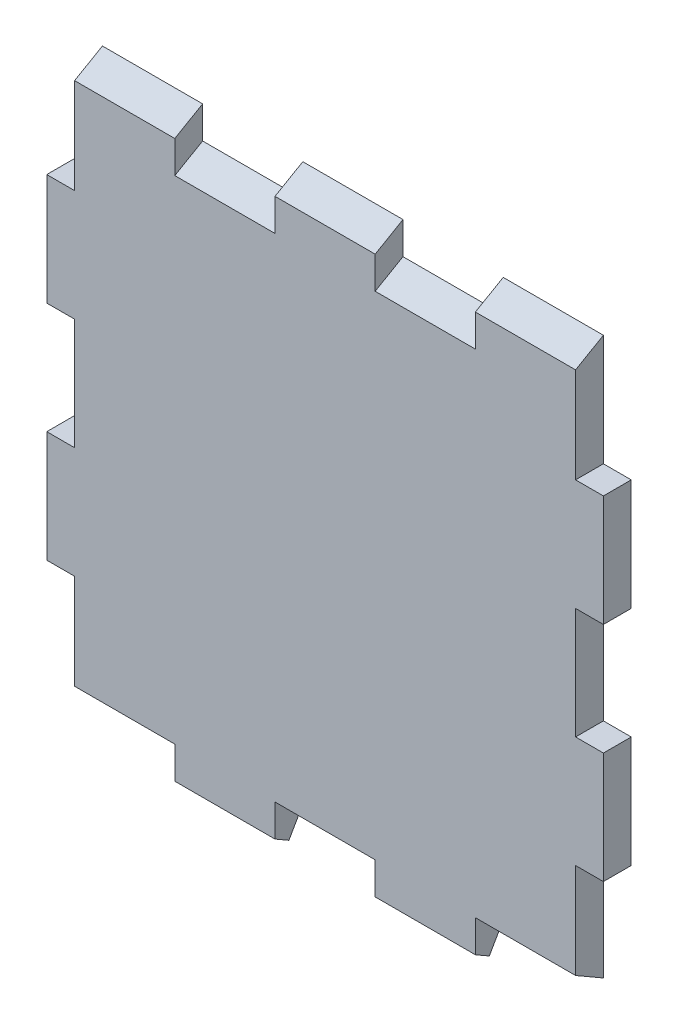
from build123d import *

# Parameters (mm, degrees)
ESQUISSE1_W                    = 90
ESQUISSE1_H                    = 100
BOSS_EXTRU_3_DEPTH             = 5
ENL_V_MAT_EXTRU_3_DEPTH        = 135.629120178
BOSS_EXTRU_4_DEPTH             = 90
ESQUISSE7_W                    = 18
ESQUISSE7_H                    = 5.773502692
ENL_V_MAT_EXTRU_4_DEPTH        = 137.787000854
ESQUISSE8_W                    = 18
ESQUISSE8_H                    = 5
ENL_V_MAT_EXTRU_5_DEPTH        = 133.498992691
ESQUISSE9_W                    = 18
ESQUISSE9_H                    = 5
ENL_V_MAT_EXTRU_6_DEPTH        = 133.498992691
BOSS_EXTRU_5_REACH             = 118.304
BOSS_EXTRU_5_DIRECTION_2_REACH = 118.304
ESQUISSE11_W                   = 18
ESQUISSE11_H                   = 13
BOSS_EXTRU_6_DEPTH             = 5
ENL_V_MAT_EXTRU_7_DEPTH        = 135.082064423
ESQUISSE13_W                   = 5
ESQUISSE13_H                   = 20
BOSS_EXTRU_7_DEPTH             = 5


with BuildPart() as part:
    # Esquisse1 → Boss.-Extru.3 (new body)
    with BuildSketch(Plane.XY):
        with Locations((-45, -50)):
            Rectangle(ESQUISSE1_W, ESQUISSE1_H)
    extrude(amount=BOSS_EXTRU_3_DEPTH)

    # Esquisse5 → Enlèv. mat.-Extru.3 (cut, through all)
    with BuildSketch(Plane(origin=(0, 0, 0), x_dir=(0, 0, -1), z_dir=(1, 0, 0))):
        Polygon((0, 0), (-5, 0), (-5, -5.773502692), (0, -2.886751346), align=None)
    extrude(amount=-ENL_V_MAT_EXTRU_3_DEPTH, mode=Mode.SUBTRACT)

    # Esquisse6 → Boss.-Extru.4 (add, through all)
    with BuildSketch(Plane(origin=(0, 0, 0), x_dir=(0, 0, -1), z_dir=(1, 0, 0))):
        Polygon((0, -100), (-5, -100), (0, -102.886751346), align=None)
    extrude(amount=-BOSS_EXTRU_4_DEPTH)

    # Esquisse7 → Enlèv. mat.-Extru.4 (cut, through all)
    with BuildSketch(Plane.XY.offset(5)):
        with Locations((-63, -8.660254038)):
            Rectangle(ESQUISSE7_W, ESQUISSE7_H)
        with Locations((-27, -8.660254038)):
            Rectangle(ESQUISSE7_W, ESQUISSE7_H)
    extrude(amount=-ENL_V_MAT_EXTRU_4_DEPTH, mode=Mode.SUBTRACT)

    # Esquisse8 → Enlèv. mat.-Extru.5 (cut, through all)
    with BuildSketch(Plane.XZ.offset(5.773502692)):
        with Locations((-63, 2.5)):
            Rectangle(ESQUISSE8_W, ESQUISSE8_H)
    extrude(amount=-ENL_V_MAT_EXTRU_5_DEPTH, mode=Mode.SUBTRACT)

    # Esquisse9 → Enlèv. mat.-Extru.6 (cut, through all)
    with BuildSketch(Plane.XZ.offset(5.773502692)):
        with Locations((-27, 2.5)):
            Rectangle(ESQUISSE9_W, ESQUISSE9_H)
    extrude(amount=-ENL_V_MAT_EXTRU_6_DEPTH, mode=Mode.SUBTRACT)

    # Esquisse10 → Boss.-Extru.5 (add, up to next)
    with BuildSketch(Plane(origin=(-36, 0, 0), x_dir=(0, 0, -1), z_dir=(1, 0, 0)), mode=Mode.PRIVATE) as boss_extru_5_sk1:
        Polygon((0, -11.547005384), (-5, -11.547005384), (0, -8.66380151), align=None)
    boss_extru_5_tool1 = extrude(boss_extru_5_sk1.sketch, amount=-BOSS_EXTRU_5_REACH, mode=Mode.PRIVATE) - part.part
    add(boss_extru_5_tool1.solids().sort_by_distance((-36, -10.585937, 1.666667))[0])

    # Esquisse10 → Boss.-Extru.5 direction 2 (add, up to next)
    with BuildSketch(Plane(origin=(-36, 0, 0), x_dir=(0, 0, -1), z_dir=(1, 0, 0)), mode=Mode.PRIVATE) as boss_extru_5_direction_2_sk1:
        Polygon((0, -11.547005384), (-5, -11.547005384), (0, -8.66380151), align=None)
    boss_extru_5_direction_2_tool1 = extrude(boss_extru_5_direction_2_sk1.sketch, amount=BOSS_EXTRU_5_DIRECTION_2_REACH, mode=Mode.PRIVATE) - part.part
    add(boss_extru_5_direction_2_tool1.solids().sort_by_distance((-36, -10.585937, 1.666667))[0])

    # Esquisse11 → Boss.-Extru.6 (add, through all)
    with BuildSketch(Plane.XY.offset(5)):
        with Locations((-63, -106.5)):
            Rectangle(ESQUISSE11_W, ESQUISSE11_H)
        with Locations((-27, -106.5)):
            Rectangle(ESQUISSE11_W, ESQUISSE11_H)
    extrude(amount=-BOSS_EXTRU_6_DEPTH)

    # Esquisse12 → Enlèv. mat.-Extru.7 (cut, through all)
    with BuildSketch(Plane.ZY.offset(72)):
        Polygon((0, -102.886751346), (2.5, -107.216878365), (5, -105.773502692), (5, -113), (0, -113), align=None)
    extrude(amount=-ENL_V_MAT_EXTRU_7_DEPTH, mode=Mode.SUBTRACT)

    # Esquisse13 → Boss.-Extru.7 (add, through all)
    with BuildSketch(Plane(origin=(0, 0, 0), x_dir=(-1, 0, 0), z_dir=(0, 0, -1))):
        with Locations((92.5, -32.886751346)):
            Rectangle(ESQUISSE13_W, ESQUISSE13_H)
        with Locations((92.5, -72.886751346)):
            Rectangle(ESQUISSE13_W, ESQUISSE13_H)
        with Locations((-2.5, -72.886751346)):
            Rectangle(ESQUISSE13_W, ESQUISSE13_H)
        with Locations((-2.5, -32.886751346)):
            Rectangle(ESQUISSE13_W, ESQUISSE13_H)
    extrude(amount=-BOSS_EXTRU_7_DEPTH)


solid = part.part
